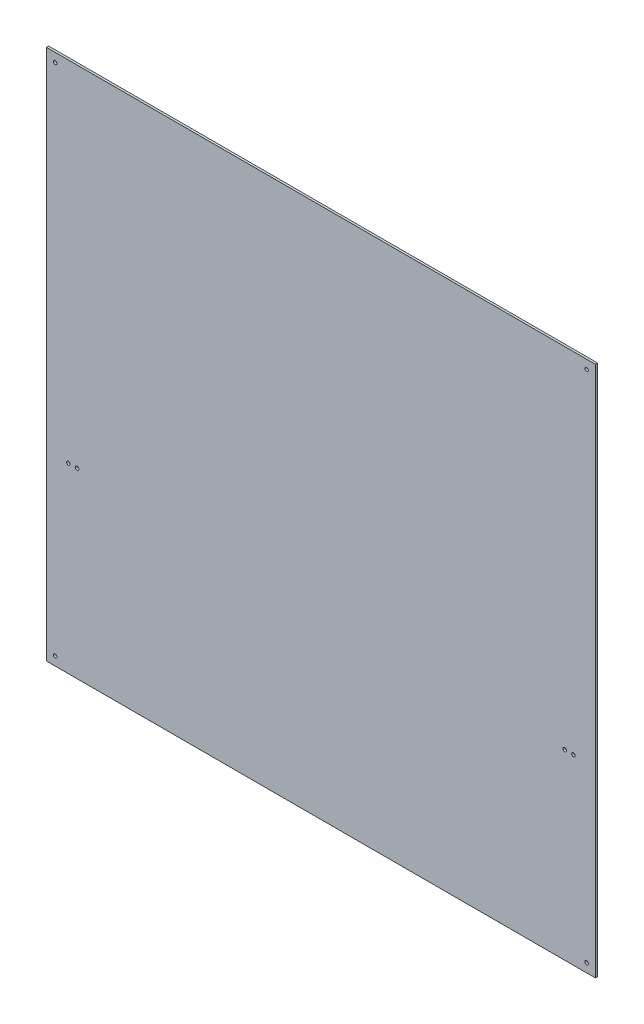
from build123d import *

# Parameters (mm, degrees)
SKETCH_1_W          = 1250
SKETCH_1_H          = 1210
EXTRUDE_1_DEPTH     = 5
SKETCH_2_R          = 4.05
CUT_EXTRUDE_1_DEPTH = 5
SKETCH_3_R          = 4.05
CUT_EXTRUDE_2_DEPTH = 5


with BuildPart() as part:
    # 草图1 → 凸台-拉伸1 (new body)
    with BuildSketch(Plane.XY):
        with Locations((-28.566371681, -50.327433628)):
            Rectangle(SKETCH_1_W, SKETCH_1_H)
    extrude(amount=EXTRUDE_1_DEPTH)

    # 草图2 → 切除-拉伸1 (cut)
    with BuildSketch(Plane.XY.offset(5)):
        with Locations((-633.566371681, 534.672566372)):
            Circle(SKETCH_2_R)
        with Locations((576.433628319, 534.672566372)):
            Circle(SKETCH_2_R)
        with Locations((576.433628319, -635.327433628)):
            Circle(SKETCH_2_R)
        with Locations((-633.566371681, -635.327433628)):
            Circle(SKETCH_2_R)
    extrude(amount=-CUT_EXTRUDE_1_DEPTH, mode=Mode.SUBTRACT)

    # 草图3 → 切除-拉伸2 (cut)
    with BuildSketch(Plane.XY.offset(5)):
        with Locations((-603.566371681, -240.327433628)):
            Circle(SKETCH_3_R)
        with Locations((526.433628319, -240.327433628)):
            Circle(SKETCH_3_R)
        with Locations((-583.566371681, -240.327433628)):
            Circle(SKETCH_3_R)
        with Locations((546.433628319, -240.327433628)):
            Circle(SKETCH_3_R)
    extrude(amount=-CUT_EXTRUDE_2_DEPTH, mode=Mode.SUBTRACT)


solid = part.part
